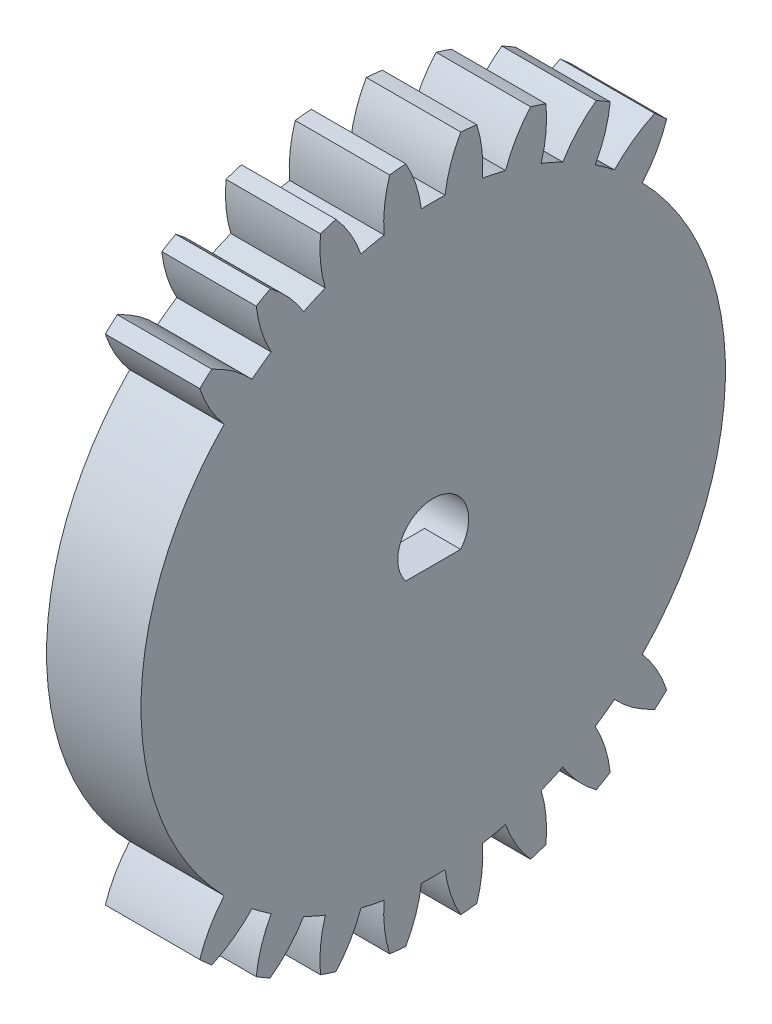
from build123d import *

# Parameters (mm, degrees)
BASPROSKE_W        = 4
BASPROSKE_H        = 14.4
TOOTHCUT_DEPTH     = 21.753794834
TEETHCUTS_COUNT    = 30
TEETHCUTS_ANGLE    = 348
BORE_DEPTH         = 50.0000508
CUT_EXTRUDE2_START = -10
CUT_EXTRUDE2_DEPTH = 10
CUT_EXTRUDE3_START = -2.47
SKETCH3_R          = 1.5
CUT_EXTRUDE3_DEPTH = 2.47


with BuildPart() as part:
    # BasProSke → Base-Revolve (revolve)
    with BuildSketch(Plane(origin=(0, 0, 0), x_dir=(1, 0, 0), z_dir=(0, 1, 0)), mode=Mode.PRIVATE) as base_revolve_sk:
        with Locations((2, 7.2)):
            Rectangle(BASPROSKE_W, BASPROSKE_H)
    revolve(base_revolve_sk.sketch.rotate(Axis((-10, 0, 0), (1, 0, 0)), 180), axis=Axis((-10, 0, 0), (1, 0, 0)))

    # TooCutSke → ToothCut (cut, through all)
    with BuildSketch(Plane(origin=(0, 0, 0), x_dir=(0, 0, -1), z_dir=(1, 0, 0))):
        with BuildLine():
            ThreePointArc((0.502005058, 12.363812799), (0, 12.374), (-0.502005058, 12.363812799))
            ThreePointArc((-0.502005058, 12.363812799), (-0.740487606, 13.404090158), (-1.178907792, 14.377146503))
            ThreePointArc((-1.178907792, 14.377146503), (0, 14.4254), (1.178907792, 14.377146503))
            ThreePointArc((1.178907792, 14.377146503), (0.740487606, 13.404090158), (0.502005058, 12.363812799))
        make_face()
    toothcut = extrude(amount=TOOTHCUT_DEPTH, mode=Mode.SUBTRACT)

    # TeethCuts: ToothCut ×30 about axis
    teethcuts_axis = Axis((-10, 0, 0), (1, 0, 0))
    for i in range(1, TEETHCUTS_COUNT):
        add(toothcut.rotate(teethcuts_axis, i * TEETHCUTS_ANGLE / (TEETHCUTS_COUNT - 1)), mode=Mode.SUBTRACT)

    # BorSke → Bore (cut, symmetric)
    with BuildSketch(Plane(origin=(0, 0, 0), x_dir=(0, 0, -1), z_dir=(1, 0, 0))):
        with BuildLine():
            Line((-1.160818677, -0.95), (1.160818677, -0.95))
            ThreePointArc((1.160818677, -0.95), (0, 1.5), (-1.160818677, -0.95))
        make_face()
    extrude(amount=BORE_DEPTH, both=True, mode=Mode.SUBTRACT)

    # Sketch1 → Cut-Extrude2 (cut)
    with BuildSketch(Plane(origin=(4, 0, 0), x_dir=(0, 0, -1), z_dir=(1, 0, 0)).offset(CUT_EXTRUDE2_START)):
        with BuildLine():
            Line((-9.19567407, 8.279822123), (-11.837430087, 9.990379384))
            ThreePointArc((-11.837430087, 9.990379384), (-15.480248321, -0.542534064), (-11.108982601, -10.79457905))
            Line((-11.108982601, -10.79457905), (-9.083189008, -8.403068097))
            ThreePointArc((-9.083189008, -8.403068097), (-12.373718737, -0.083430299), (-9.19567407, 8.279822123))
        make_face()
        with BuildLine():
            Line((9.083189008, -8.403068097), (11.108982601, -10.79457905))
            ThreePointArc((11.108982601, -10.79457905), (15.480248321, -0.542534064), (11.837430087, 9.990379384))
            Line((11.837430087, 9.990379384), (9.19567407, 8.279822123))
            ThreePointArc((9.19567407, 8.279822123), (12.373718737, -0.083430299), (9.083189008, -8.403068097))
        make_face()
    extrude(amount=CUT_EXTRUDE2_DEPTH, mode=Mode.SUBTRACT)

    # Sketch3 → Cut-Extrude3 (cut)
    with BuildSketch(Plane.ZY.offset(CUT_EXTRUDE3_START)):
        with Locations(Location((0, 0, 0), (0, 0, 320.703519761))):
            Circle(SKETCH3_R)
    extrude(amount=CUT_EXTRUDE3_DEPTH, mode=Mode.SUBTRACT)


solid = part.part
